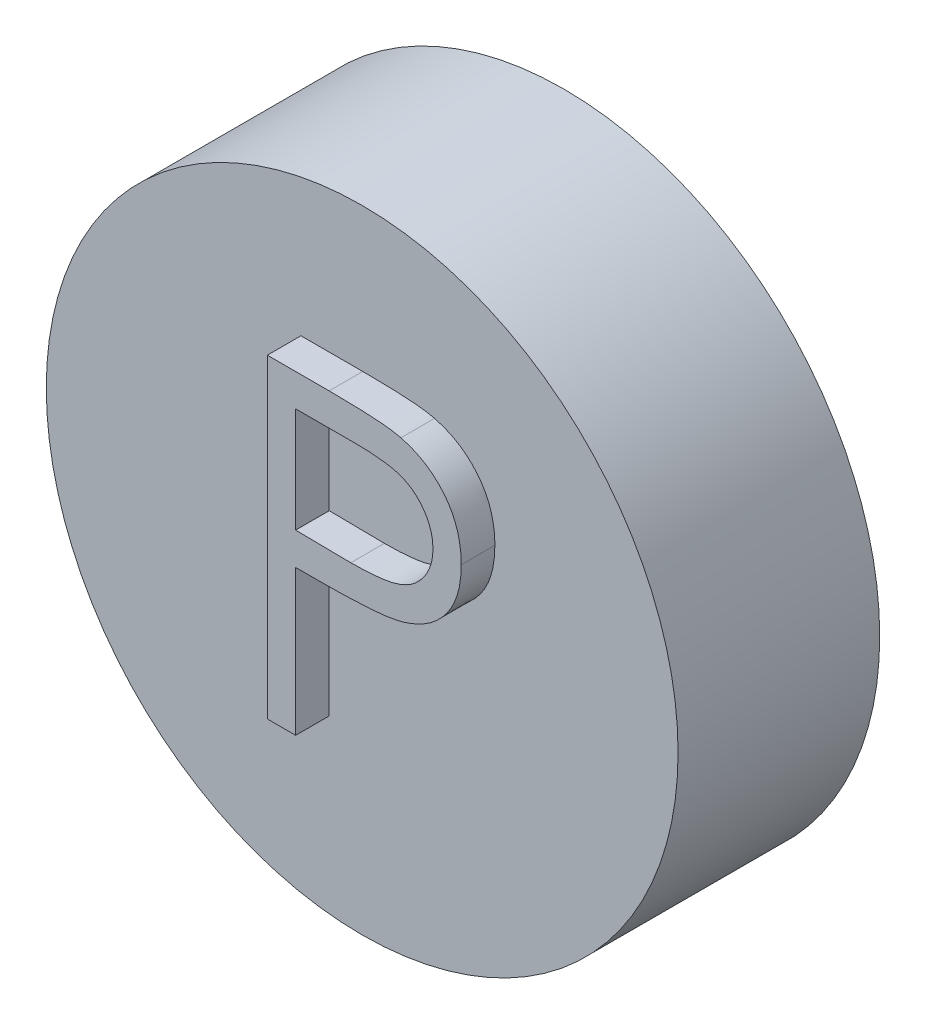
from build123d import *

# Parameters (mm, degrees)
SKETCH1_R           = 11.938
SKETCH1_R_2         = 8.763
BOSS_EXTRUDE1_DEPTH = 5.08
SKETCH2_R           = 11.938
BOSS_EXTRUDE2_DEPTH = 2.54
BOSS_EXTRUDE3_DEPTH = 1.27


with BuildPart() as part:
    # Sketch1 → Boss-Extrude1 (new body)
    with BuildSketch(Plane.XY):
        Circle(SKETCH1_R)
        Circle(SKETCH1_R_2, mode=Mode.SUBTRACT)
    extrude(amount=BOSS_EXTRUDE1_DEPTH)

    # Sketch2 → Boss-Extrude2 (add)
    with BuildSketch(Plane.XY.offset(5.08)):
        Circle(SKETCH2_R)
    extrude(amount=BOSS_EXTRUDE2_DEPTH)

    # Sketch3 → Boss-Extrude3 (add)
    with BuildSketch(Plane.XY.offset(7.62)):
        with BuildLine():
            Line((-2.313117578, 6.515240045), (0.02186214, 6.515240045))
            add(Edge.make_bspline(
                [(0.02186214, 6.515240045), (0.182463526, 6.515063505), (0.490182914, 6.514725246), (0.931445737, 6.504469727), (1.332209199, 6.490771783), (1.691609156, 6.471783379), (2.010751418, 6.449343193), (2.288191875, 6.417869737), (2.526111258, 6.385007482), (2.668668019, 6.351597161), (2.733682302, 6.336360087)],
                knots=[0, 0, 0, 0, 1.415646017, 2.712440637, 3.8905458, 4.950247383, 5.884950622, 6.709939814, 7.411656543, 8, 8, 8, 8], degree=3))
            add(Edge.make_bspline(
                [(2.733682302, 6.336360087), (2.81598352, 6.313833632), (2.97864663, 6.269311531), (3.213033214, 6.180138061), (3.436033349, 6.074403196), (3.648412132, 5.953898543), (3.847559754, 5.813453901), (4.036447447, 5.658762398), (4.213408273, 5.486252508), (4.377447115, 5.297859098), (4.528094507, 5.096744813), (4.657803517, 4.879907406), (4.766413102, 4.650996811), (4.859565123, 4.410172252), (4.926609062, 4.15541142), (4.977115034, 3.888484478), (5.009172195, 3.609420041), (5.012242517, 3.418716385), (5.013805499, 3.321636529)],
                knots=[0, 0, 0, 0, 0.999701418, 1.975846123, 2.934577507, 3.890451536, 4.834027766, 5.787354733, 6.749476667, 7.726910423, 8.712836071, 9.690891519, 10.682875813, 11.679750201, 12.712814741, 13.765529915, 14.8625177, 16, 16, 16, 16], degree=3))
            add(Edge.make_bspline(
                [(5.013805499, 3.321636529), (5.012371903, 3.223740699), (5.009566974, 3.032200896), (4.975901932, 2.751986322), (4.930555476, 2.484203227), (4.860828897, 2.229445364), (4.769505669, 1.989225645), (4.662376454, 1.759873061), (4.533164623, 1.545289534), (4.384694265, 1.344696036), (4.219532145, 1.157904281), (4.03837706, 0.986267882), (3.84196036, 0.830791516), (3.630906267, 0.691126633), (3.403157228, 0.570511968), (3.162167402, 0.462480421), (2.905842112, 0.371751188), (2.728464453, 0.324023926), (2.638279658, 0.299757773)],
                knots=[0, 0, 0, 0, 1.121902311, 2.195077645, 3.232258892, 4.234102512, 5.217864754, 6.176164875, 7.132989551, 8.084763148, 9.034132444, 9.988522005, 10.94243251, 11.903244335, 12.886203696, 13.894208494, 14.929344452, 16, 16, 16, 16], degree=3))
            add(Edge.make_bspline(
                [(2.638279658, 0.299757773), (2.563687566, 0.283895311), (2.400214661, 0.249131802), (2.130988079, 0.210322676), (1.817529222, 0.177197445), (1.46026593, 0.15236054), (1.059518887, 0.131098126), (0.615071307, 0.114197735), (0.126050741, 0.104911357), (-0.215050545, 0.10443241), (-0.393139363, 0.104182352)],
                knots=[0, 0, 0, 0, 0.601384939, 1.31797006, 2.144135048, 3.087295005, 4.142315834, 5.309527816, 6.595305764, 8, 8, 8, 8], degree=3))
            Line((-0.393139363, 0.104182352), (-1.244607962, 0.104182352))
            Line((-1.244607962, 0.104182352), (-1.244607962, -5.391009955))
            Line((-1.244607962, -5.391009955), (-2.313117578, -5.391009955))
            Line((-2.313117578, -5.391009955), (-2.313117578, 6.515240045))
        make_face()
        with BuildLine():
            Line((-1.244607962, 5.294086198), (-1.244607962, 1.325336198))
            Line((-1.244607962, 1.325336198), (0.839939814, 1.299100471))
            add(Edge.make_bspline(
                [(0.839939814, 1.299100471), (0.94172099, 1.299047867), (1.138207453, 1.298946317), (1.422039605, 1.312503193), (1.685369413, 1.328153219), (1.927388013, 1.351067388), (2.148204504, 1.383456665), (2.34818708, 1.416153738), (2.525785069, 1.463456802), (2.733631461, 1.527148671), (2.96523642, 1.635776587), (3.217198348, 1.793448981), (3.430730432, 1.99442889), (3.615509638, 2.220402137), (3.762146598, 2.47179114), (3.869493322, 2.74076672), (3.932566366, 3.024570386), (3.941023864, 3.218772002), (3.945295884, 3.316866397)],
                knots=[0, 0, 0, 0, 1.160613943, 2.240541288, 3.23993089, 4.169200891, 5.011653406, 5.7853311, 6.478053781, 7.106038997, 8.262395093, 9.384106736, 10.481365981, 11.59014053, 12.70357646, 13.786202915, 14.881775077, 16, 16, 16, 16], degree=3))
            add(Edge.make_bspline(
                [(3.945295884, 3.316866397), (3.941000631, 3.41258759), (3.9324622, 3.602869475), (3.868998951, 3.881743651), (3.762355303, 4.147884753), (3.614525281, 4.396123552), (3.435111258, 4.62128368), (3.226584029, 4.816876585), (2.989434452, 4.974112913), (2.768834666, 5.075599345), (2.572887774, 5.137563809), (2.402689768, 5.180919025), (2.210520599, 5.215534257), (1.996317706, 5.24356328), (1.761741333, 5.267557643), (1.504776173, 5.283838512), (1.226395654, 5.293368466), (1.033138266, 5.293841162), (0.932957392, 5.294086198)],
                knots=[0, 0, 0, 0, 1.120700087, 2.227813068, 3.331159281, 4.466773991, 5.599788987, 6.693661531, 7.80175334, 8.91857717, 9.525282508, 10.207424825, 10.974604443, 11.810962634, 12.737642355, 13.736264703, 14.826523623, 16, 16, 16, 16], degree=3))
            Line((0.932957392, 5.294086198), (-1.244607962, 5.294086198))
        make_face(mode=Mode.SUBTRACT)
    extrude(amount=BOSS_EXTRUDE3_DEPTH)


solid = part.part
